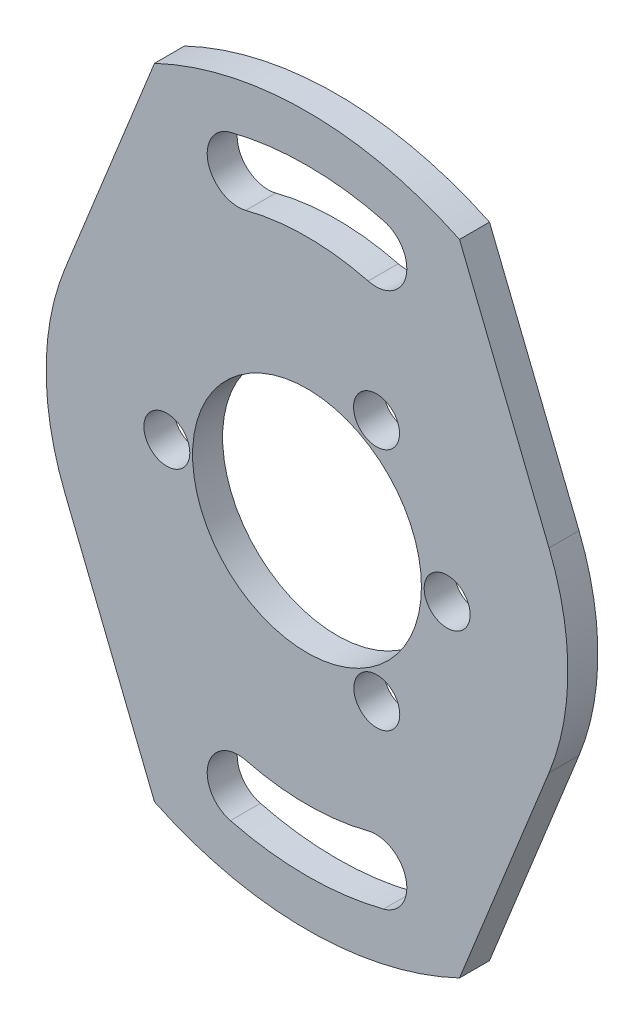
from build123d import *

# Parameters (mm, degrees)
SKETCH2_R           = 1.224840395
BOSS_EXTRUDE1_DEPTH = 1.6


with BuildPart() as part:
    # Sketch2 → Boss-Extrude1 (new body)
    # profile 1 of 12: a face of its own
    with BuildSketch(Plane.XY):
        with BuildLine():
            ThreePointArc((-8.135, -17.059653426), (-4.170284778, -18.434172747), (0, -18.9))
            Line((0, -18.9), (0, -16.415))
            ThreePointArc((0, -16.415), (-2.059106624, -16.285340184), (-4.08568405, -15.898409066))
            ThreePointArc((-4.08568405, -15.898409066), (-5.118317114, -15.09992037), (-5.247629689, -13.801000241))
            ThreePointArc((-5.247629689, -13.801000241), (-8.401661187, -12.141553208), (-11.06618513, -9.774700592))
            Line((-11.06618513, -9.774700592), (-8.135, -17.059653426))
        make_face()
    # profile 2 of 12: a face of its own
    with BuildSketch(Plane.XY):
        with BuildLine():
            Line((0, -16.415), (0, -18.9))
            ThreePointArc((0, -18.9), (4.170284778, -18.434172747), (8.135, -17.059653426))
            Line((8.135, -17.059653426), (11.06618513, -9.774700592))
            ThreePointArc((11.06618513, -9.774700592), (8.401661187, -12.141553208), (5.247629689, -13.801000241))
            ThreePointArc((5.247629689, -13.801000241), (5.118317114, -15.09992037), (4.08568405, -15.898409066))
            ThreePointArc((4.08568405, -15.898409066), (2.059106624, -16.285340184), (0, -16.415))
        make_face()
    # profile 3 of 12: a face of its own
    with BuildSketch(Plane.XY):
        with BuildLine():
            ThreePointArc((5.247629689, -13.801000241), (8.401661187, -12.141553208), (11.06618513, -9.774700592))
            Line((11.06618513, -9.774700592), (12.90921384, -5.194172026))
            ThreePointArc((12.90921384, -5.194172026), (9.679242267, -9.996974249), (4.774656023, -13.070190697))
            ThreePointArc((4.774656023, -13.070190697), (5.060206981, -13.403841589), (5.247629689, -13.801000241))
        make_face()
    # profile 4 of 12: a face of its own
    with BuildSketch(Plane.XY):
        with BuildLine():
            Line((-12.909213852, -5.194171995), (-11.06618513, -9.774700592))
            ThreePointArc((-11.06618513, -9.774700592), (-8.401661187, -12.141553208), (-5.247629689, -13.801000241))
            ThreePointArc((-5.247629689, -13.801000241), (-5.060206981, -13.403841589), (-4.774656023, -13.070190697))
            ThreePointArc((-4.774656023, -13.070190697), (-9.679242279, -9.996974238), (-12.909213852, -5.194171995))
        make_face()
    # profile 5 of 12: a face of its own
    with BuildSketch(Plane.XY):
        with BuildLine():
            ThreePointArc((-12.909213987, 5.194171661), (-13.915, -1.8e-07), (-12.909213852, -5.194171995))
            ThreePointArc((-12.909213852, -5.194171995), (-9.679242279, -9.996974238), (-4.774656023, -13.070190697))
            ThreePointArc((-4.774656023, -13.070190697), (-4.065529678, -12.697217895), (-3.26431595, -12.702262254))
            ThreePointArc((-3.26431595, -12.702262254), (-1.64515281, -13.011406428), (0, -13.115))
            Line((0, -13.115), (0, -10.854127302))
            ThreePointArc((0, -10.854127302), (-10.854127302, 0), (0, 10.854127302))
            Line((0, 10.854127302), (0, 13.115))
            ThreePointArc((0, 13.115), (-1.64515281, 13.011406428), (-3.26431595, 12.702262254))
            ThreePointArc((-3.26431595, 12.702262254), (-4.065529678, 12.697217895), (-4.774656023, 13.070190697))
            ThreePointArc((-4.774656023, 13.070190697), (-9.679242408, 9.996974112), (-12.909213987, 5.194171661))
        make_face()
    # profile 6 of 12: a face of its own
    with BuildSketch(Plane.XY):
        with BuildLine():
            Line((-11.06618513, 9.774700592), (-12.909213987, 5.194171661))
            ThreePointArc((-12.909213987, 5.194171661), (-9.679242408, 9.996974112), (-4.774656023, 13.070190697))
            ThreePointArc((-4.774656023, 13.070190697), (-5.060206981, 13.403841589), (-5.247629689, 13.801000241))
            ThreePointArc((-5.247629689, 13.801000241), (-8.401661187, 12.141553208), (-11.06618513, 9.774700592))
        make_face()
    # profile 7 of 12: a face of its own
    with BuildSketch(Plane.XY):
        with BuildLine():
            Line((-8.135, 17.059653426), (-11.06618513, 9.774700592))
            ThreePointArc((-11.06618513, 9.774700592), (-8.401661187, 12.141553208), (-5.247629689, 13.801000241))
            ThreePointArc((-5.247629689, 13.801000241), (-5.118317114, 15.09992037), (-4.08568405, 15.898409066))
            ThreePointArc((-4.08568405, 15.898409066), (-2.059106624, 16.285340184), (0, 16.415))
            Line((0, 16.415), (0, 18.9))
            ThreePointArc((0, 18.9), (-4.170284778, 18.434172747), (-8.135, 17.059653426))
        make_face()
    # profile 8 of 12: a face of its own
    with BuildSketch(Plane.XY):
        with BuildLine():
            ThreePointArc((4.774656023, 13.070190697), (9.679242519, 9.996974005), (12.909214102, 5.194171376))
            Line((12.909214102, 5.194171376), (11.06618513, 9.774700592))
            ThreePointArc((11.06618513, 9.774700592), (8.401661187, 12.141553208), (5.247629689, 13.801000241))
            ThreePointArc((5.247629689, 13.801000241), (5.060206981, 13.403841589), (4.774656023, 13.070190697))
        make_face()
    # profile 9 of 12: a face of its own
    with BuildSketch(Plane.XY):
        with BuildLine():
            ThreePointArc((4.774656023, -13.070190697), (9.679242267, -9.996974249), (12.90921384, -5.194172026))
            ThreePointArc((12.90921384, -5.194172026), (13.661239614, -2.645327429), (13.915, 0))
            ThreePointArc((13.915, 0), (13.661239681, 2.645327085), (12.909214102, 5.194171376))
            ThreePointArc((12.909214102, 5.194171376), (9.679242519, 9.996974005), (4.774656023, 13.070190697))
            ThreePointArc((4.774656023, 13.070190697), (4.065529678, 12.697217895), (3.26431595, 12.702262254))
            ThreePointArc((3.26431595, 12.702262254), (1.64515281, 13.011406428), (0, 13.115))
            Line((0, 13.115), (0, 10.854127302))
            ThreePointArc((0, 10.854127302), (7.675027019, 7.675027019), (10.854127302, 0))
            ThreePointArc((10.854127302, 0), (7.675027019, -7.675027019), (0, -10.854127302))
            Line((0, -10.854127302), (0, -13.115))
            ThreePointArc((0, -13.115), (1.64515281, -13.011406428), (3.26431595, -12.702262254))
            ThreePointArc((3.26431595, -12.702262254), (4.065529678, -12.697217895), (4.774656023, -13.070190697))
        make_face()
    # profile 10 of 12: a face of its own
    with BuildSketch(Plane.XY):
        with BuildLine():
            ThreePointArc((5.247629689, 13.801000241), (8.401661187, 12.141553208), (11.06618513, 9.774700592))
            Line((11.06618513, 9.774700592), (8.135, 17.059653426))
            ThreePointArc((8.135, 17.059653426), (4.170284778, 18.434172747), (0, 18.9))
            Line((0, 18.9), (0, 16.415))
            ThreePointArc((0, 16.415), (2.059106624, 16.285340184), (4.08568405, 15.898409066))
            ThreePointArc((4.08568405, 15.898409066), (5.118317114, 15.09992037), (5.247629689, 13.801000241))
        make_face()
    # profile 11 of 12: a face of its own
    with BuildSketch(Plane.XY):
        with BuildLine():
            ThreePointArc((0, 10.854127302), (-10.854127302, 0), (0, -10.854127302))
            Line((0, -10.854127302), (0, -6.103787969))
            ThreePointArc((0, -6.103787969), (-6.103787969, 0), (0, 6.103787969))
            Line((0, 6.103787969), (0, 10.854127302))
        make_face()
        with Locations((-7.476059495, 0)):
            Circle(SKETCH2_R, mode=Mode.SUBTRACT)
    # profile 12 of 12: a face of its own
    with BuildSketch(Plane.XY):
        with BuildLine():
            Line((0, -6.103787969), (0, -10.854127302))
            ThreePointArc((0, -10.854127302), (7.675027019, -7.675027019), (10.854127302, 0))
            ThreePointArc((10.854127302, 0), (7.675027019, 7.675027019), (0, 10.854127302))
            Line((0, 10.854127302), (0, 6.103787969))
            ThreePointArc((0, 6.103787969), (4.316029864, 4.316029864), (6.103787969, 0))
            ThreePointArc((6.103787969, 0), (4.316029864, -4.316029864), (0, -6.103787969))
        make_face()
        with Locations((3.72330191, -6.482938258)):
            Circle(SKETCH2_R, mode=Mode.SUBTRACT)
        with Locations((7.476059495, 0)):
            Circle(SKETCH2_R, mode=Mode.SUBTRACT)
        with Locations((3.708670732, 6.491319355)):
            Circle(SKETCH2_R, mode=Mode.SUBTRACT)
    extrude(amount=BOSS_EXTRUDE1_DEPTH)


solid = part.part
